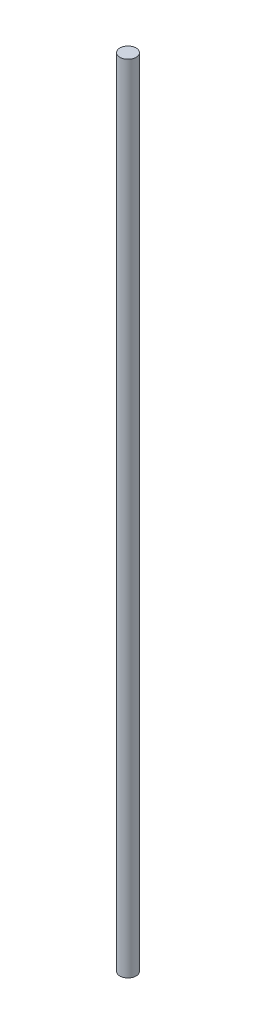
from build123d import *

# Parameters (mm, degrees)
SKETCH_1_R      = 0.5
EXTRUDE_1_DEPTH = 49


with BuildPart() as part:
    # 草圖1 → 填料-伸長1 (new body)
    with BuildSketch(Plane(origin=(0, 0, 0), x_dir=(1, 0, 0), z_dir=(0, 1, 0))):
        with Locations(Location((0, 0, 0), (0, 0, 270))):
            Circle(SKETCH_1_R)
    extrude(amount=EXTRUDE_1_DEPTH)


solid = part.part
